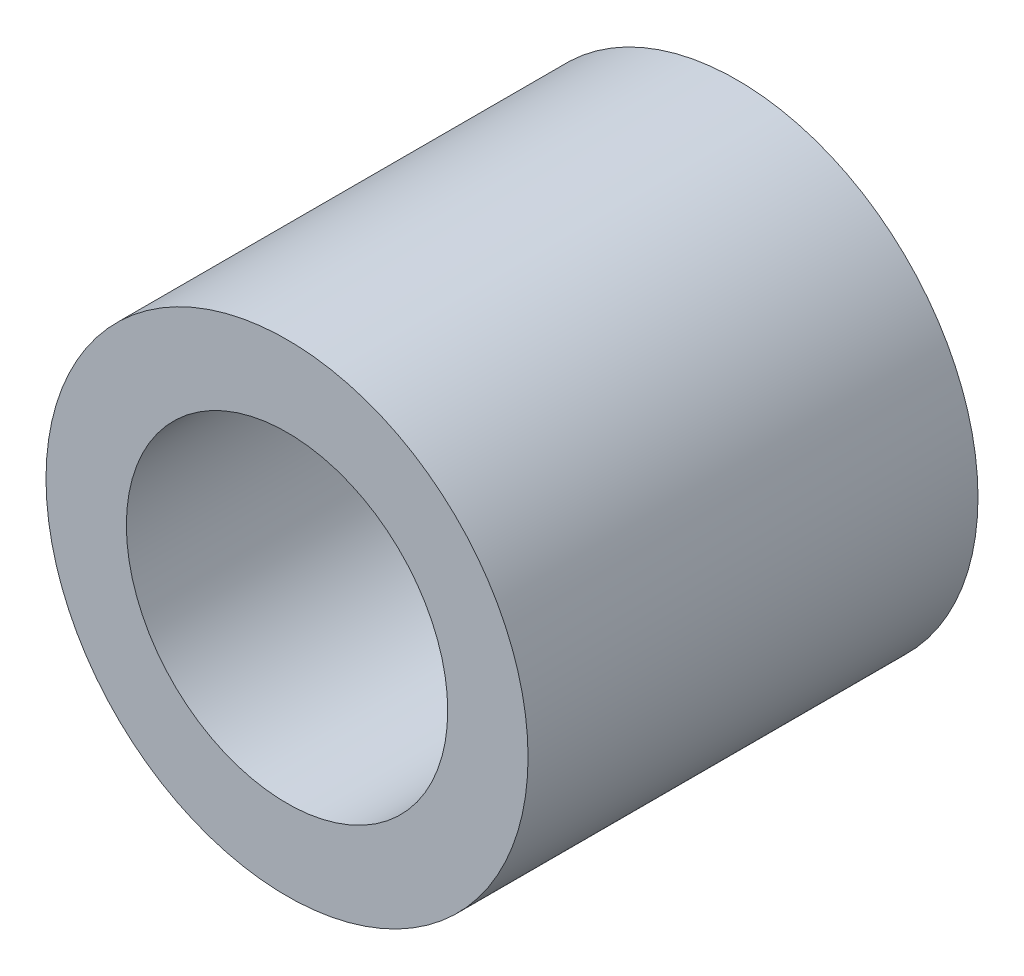
from build123d import *

# Parameters (mm, degrees)
SKETCH1_R           = 3.75
BOSS_EXTRUDE1_DEPTH = 7
SKETCH2_R           = 2.5
CUT_EXTRUDE1_DEPTH  = 5


with BuildPart() as part:
    # Sketch1 → Boss-Extrude1 (new body)
    with BuildSketch(Plane.XY):
        Circle(SKETCH1_R)
    extrude(amount=BOSS_EXTRUDE1_DEPTH)

    # Sketch2 → Cut-Extrude1 (cut)
    with BuildSketch(Plane.XY.offset(7)):
        Circle(SKETCH2_R)
    extrude(amount=-CUT_EXTRUDE1_DEPTH, mode=Mode.SUBTRACT)


solid = part.part
